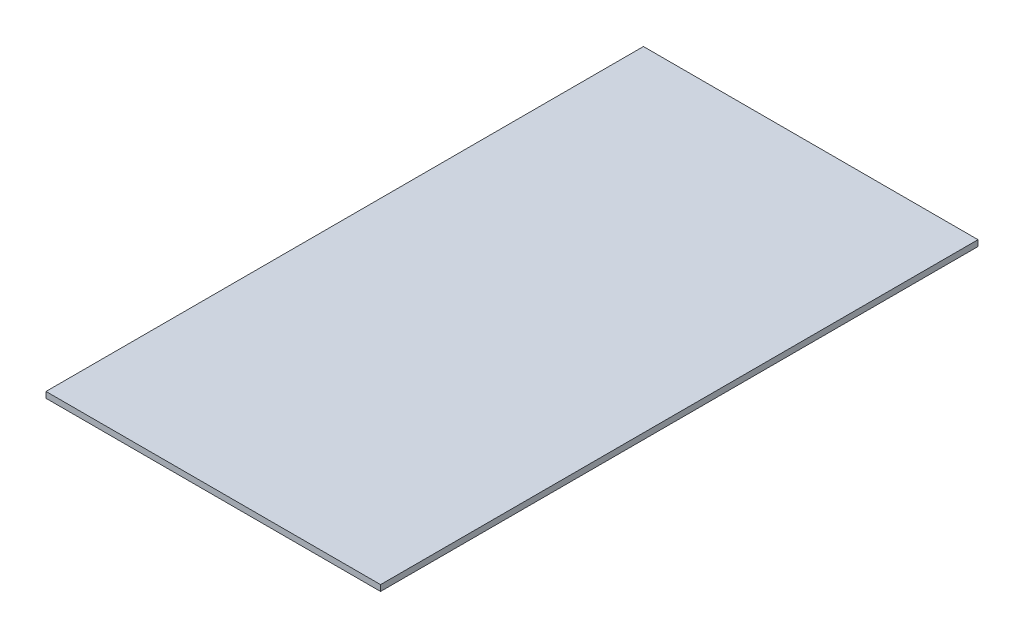
from build123d import *

# Parameters (mm, degrees)
SKETCH1_W           = 280
SKETCH1_H           = 500
BOSS_EXTRUDE1_DEPTH = 5


with BuildPart() as part:
    # Sketch1 → Boss-Extrude1 (new body)
    with BuildSketch(Plane(origin=(0, 0, 0), x_dir=(1, 0, 0), z_dir=(0, 1, 0))):
        with Locations((-94.578448042, -195.767163373)):
            Rectangle(SKETCH1_W, SKETCH1_H)
    extrude(amount=BOSS_EXTRUDE1_DEPTH)


solid = part.part
